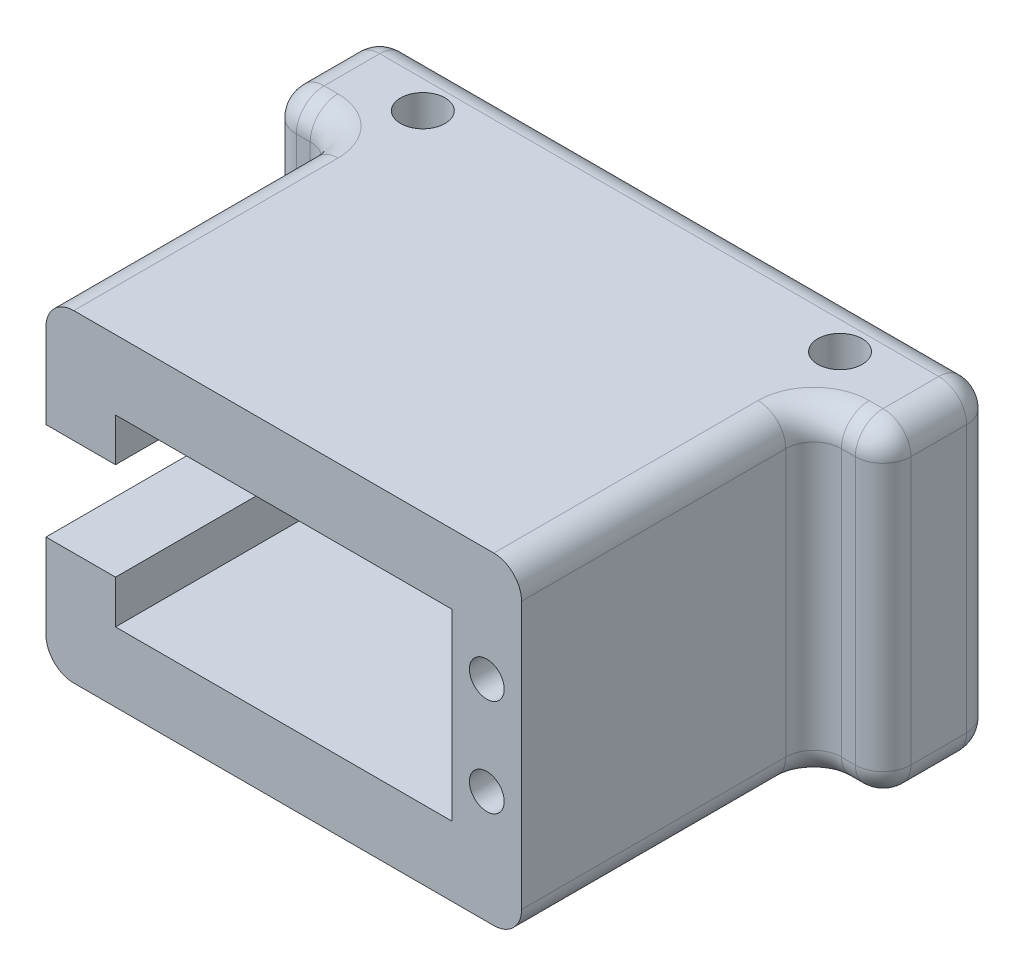
from build123d import *

# Parameters (mm, degrees)
SKETCH2_W           = 34.2
SKETCH2_H           = 23.2
SKETCH2_W_2         = 24.2
SKETCH2_H_2         = 13.2
BOSS_EXTRUDE1_DEPTH = 21
SKETCH2_2_W         = 34.2
SKETCH2_2_H         = 23.2
SKETCH2_2_W_2       = 24.2
SKETCH2_2_H_2       = 13.2
BOSS_EXTRUDE2_DEPTH = 8
BOSS_EXTRUDE3_DEPTH = 23.2
SKETCH3_R           = 1.6
CUT_EXTRUDE1_DEPTH  = 39.309920386
FILLET1_R           = 2
SKETCH5_W           = 5
SKETCH5_H           = 7
CUT_EXTRUDE2_DEPTH  = 19
SKETCH6_R           = 1.25
CUT_EXTRUDE3_DEPTH  = 6


with BuildPart() as part:
    # Sketch2 → Boss-Extrude1 (new body)
    with BuildSketch(Plane.XY):
        Rectangle(SKETCH2_W, SKETCH2_H)
        Rectangle(SKETCH2_W_2, SKETCH2_H_2, mode=Mode.SUBTRACT)
    extrude(amount=BOSS_EXTRUDE1_DEPTH)

    # Sketch2<2> → Boss-Extrude2 (add)
    # profile 1 of 2: a face of its own
    with BuildSketch(Plane.XY):
        Rectangle(SKETCH2_2_W, SKETCH2_2_H)
        Rectangle(SKETCH2_2_W_2, SKETCH2_2_H_2, mode=Mode.SUBTRACT)
    # profile 2 of 2: a face of its own
    with BuildSketch(Plane.XY):
        Rectangle(SKETCH2_2_W_2, SKETCH2_2_H_2)
    extrude(amount=-BOSS_EXTRUDE2_DEPTH)

    # Sketch4 → Boss-Extrude3 (add)
    with BuildSketch(Plane.XZ.offset(11.6)):
        Polygon((12.1, 0), (-12.1, 0), (-22.1, 0), (-22.1, -8), (-17.1, -8), (17.1, -8), (22.1, -8), (22.1, 0), align=None)
    extrude(amount=-BOSS_EXTRUDE3_DEPTH)

    # Sketch3 → Cut-Extrude1 (cut, through all)
    with BuildSketch(Plane.XZ.offset(11.6)):
        with Locations(Location((-15, -4, 0), (0, 0, 270))):
            Circle(SKETCH3_R)
        with Locations(Location((15, -4, 0), (0, 0, 270))):
            Circle(SKETCH3_R)
    extrude(amount=-CUT_EXTRUDE1_DEPTH, mode=Mode.SUBTRACT)

    # Fillet1
    fillet1_edges = [part.edges().sort_by_distance(p)[0] for p in [
        (0, -11.6, -8),
        (0, 11.6, -8),
        (-17.1, 0, 0),
        (22.1, 0, -8),
        (17.1, 0, 0),
        (-22.1, 0, 0),
        (19.6, -11.6, 0),
        (22.1, -11.6, -4),
        (-19.6, -11.6, 0),
        (-22.1, -11.6, -4),
        (19.6, 11.6, 0),
        (22.1, 11.6, -4),
        (-19.6, 11.6, 0),
        (-22.1, 11.6, -4),
        (22.1, 0, 0),
        (-22.1, 0, -8),
        (-17.1, -11.6, 10.5),
        (-17.1, 11.6, 10.5),
        (17.1, 11.6, 10.5),
        (17.1, -11.6, 10.5),
    ]]
    fillet(fillet1_edges, radius=FILLET1_R)

    # Sketch5 → Cut-Extrude2 (cut)
    with BuildSketch(Plane.XY.offset(21)):
        with Locations((-14.6, 0)):
            Rectangle(SKETCH5_W, SKETCH5_H)
    extrude(amount=-CUT_EXTRUDE2_DEPTH, mode=Mode.SUBTRACT)

    # Sketch6 → Cut-Extrude3 (cut)
    with BuildSketch(Plane.XY.offset(21)):
        with Locations((14.6, 3.5)):
            Circle(SKETCH6_R)
        with Locations(Location((14.6, -3.5, 0), (0, 0, 180))):
            Circle(SKETCH6_R)
    extrude(amount=-CUT_EXTRUDE3_DEPTH, mode=Mode.SUBTRACT)


solid = part.part
